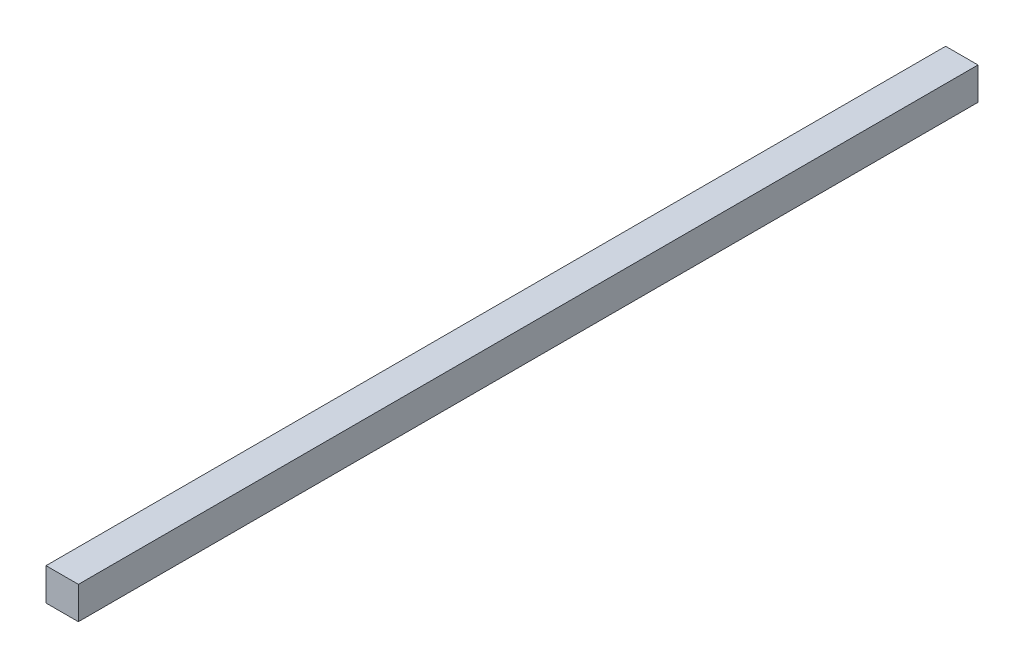
from build123d import *

# Parameters (mm, degrees)
SKETCH1_W           = 18
SKETCH1_H           = 18
BOSS_EXTRUDE1_DEPTH = 500


with BuildPart() as part:
    # Sketch1 → Boss-Extrude1 (new body)
    with BuildSketch(Plane.XY):
        with Locations((-80, 0)):
            Rectangle(SKETCH1_W, SKETCH1_H)
    extrude(amount=BOSS_EXTRUDE1_DEPTH)


solid = part.part
